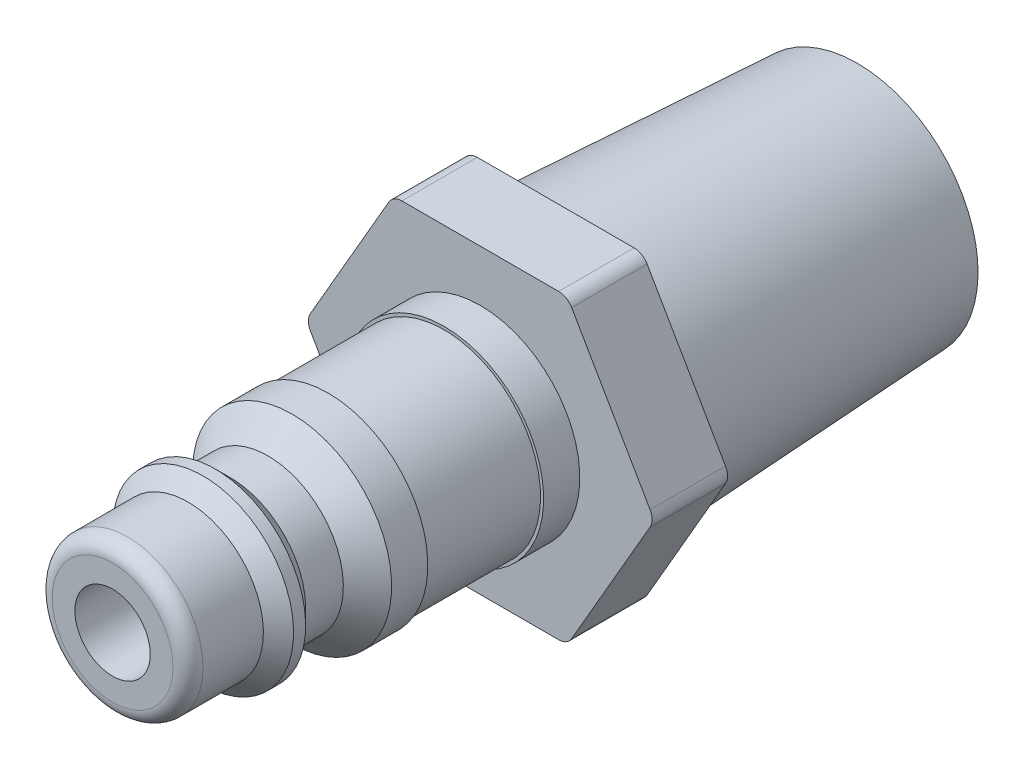
from build123d import *

# Parameters (mm, degrees)
SKETCH2_R          = 31.732831761
CUT_EXTRUDE1_DEPTH = 26.78316707
SKETCH3_R          = 11.120214541
SKETCH3_R_2        = 5.08
CUT_EXTRUDE2_DEPTH = 12.7
CUT_EXTRUDE2_DRAFT = -3
FILLET1_R          = 0.635


with BuildPart() as part:
    # Sketch1 → Revolve1 (revolve)
    with BuildSketch(Plane(origin=(0, 0, 0), x_dir=(0, 0, -1), z_dir=(1, 0, 0)), mode=Mode.PRIVATE) as revolve1_sk:
        Polygon((3.175, 3.175), (3.81, 3.81), (4.318, 3.81), (4.953, 3.175), (6.5405, 3.175), (7.5565, 4.191), (9.0805, 4.191), (9.0805, 4.064), (13.954125, 4.064), (13.954125, 4.191), (15.478125, 4.191), (15.478125, 14.36586369), (31.353125, 14.36586369), (31.353125, 0), (12.7, 0), (12.7, 1.5875), (0, 1.5875), (0, 3.175), align=None)
    revolve(revolve1_sk.sketch.rotate(Axis((0, 0, -12.7), (0, 0, -1)), 180), axis=Axis((0, 0, -12.7), (0, 0, -1)))

    # Sketch2 → Cut-Extrude1 (cut, through all)
    with BuildSketch(Plane(origin=(0, 0, -15.478125), x_dir=(-1, 0, 0), z_dir=(0, 0, -1))):
        Circle(SKETCH2_R)
        Polygon((7.332348419, 0), (3.666174209, 6.35), (-3.666174209, 6.35), (-7.332348419, 0), (-3.666174209, -6.35), (3.666174209, -6.35), align=None, mode=Mode.SUBTRACT)
    extrude(amount=CUT_EXTRUDE1_DEPTH, mode=Mode.SUBTRACT)


with BuildPart() as cut_extrude2_tool:
    # Sketch3 → Cut-Extrude2 (with draft: the straight prism first)
    with BuildSketch(Plane(origin=(0, 0, -31.353125), x_dir=(-1, 0, 0), z_dir=(0, 0, -1))):
        Circle(SKETCH3_R)
        Circle(SKETCH3_R_2, mode=Mode.SUBTRACT)
    extrude(amount=-CUT_EXTRUDE2_DEPTH)
    # Cut-Extrude2: the draft: its side faces are tilted about the plane it starts from
    cut_extrude2_sides = [cut_extrude2_tool.faces().sort_by_distance(p)[0] for p in [
        (11.120214541, 0, -25.003125),
        (5.08, 0, -25.003125),
    ]]
    draft(cut_extrude2_sides, Plane(origin=(0, 0, -31.353125), x_dir=(-1, 0, 0), z_dir=(0, 0, -1)), CUT_EXTRUDE2_DRAFT)


with BuildPart() as part_1:
    add(part.part)

    # Cut-Extrude2: cut by cut_extrude2_tool
    add(cut_extrude2_tool.part, mode=Mode.SUBTRACT)

    # Fillet1
    fillet1_edges = [part_1.edges().sort_by_distance(p)[0] for p in [
        (0, 3.175, 0),
        (-3.666174209, -6.35, -17.065625),
        (3.666174209, -6.35, -17.065625),
        (7.332348419, 0, -17.065625),
        (3.666174209, 6.35, -17.065625),
        (-3.666174209, 6.35, -17.065625),
        (-7.332348419, 0, -17.065625),
    ]]
    fillet(fillet1_edges, radius=FILLET1_R)


solid = part_1.part
